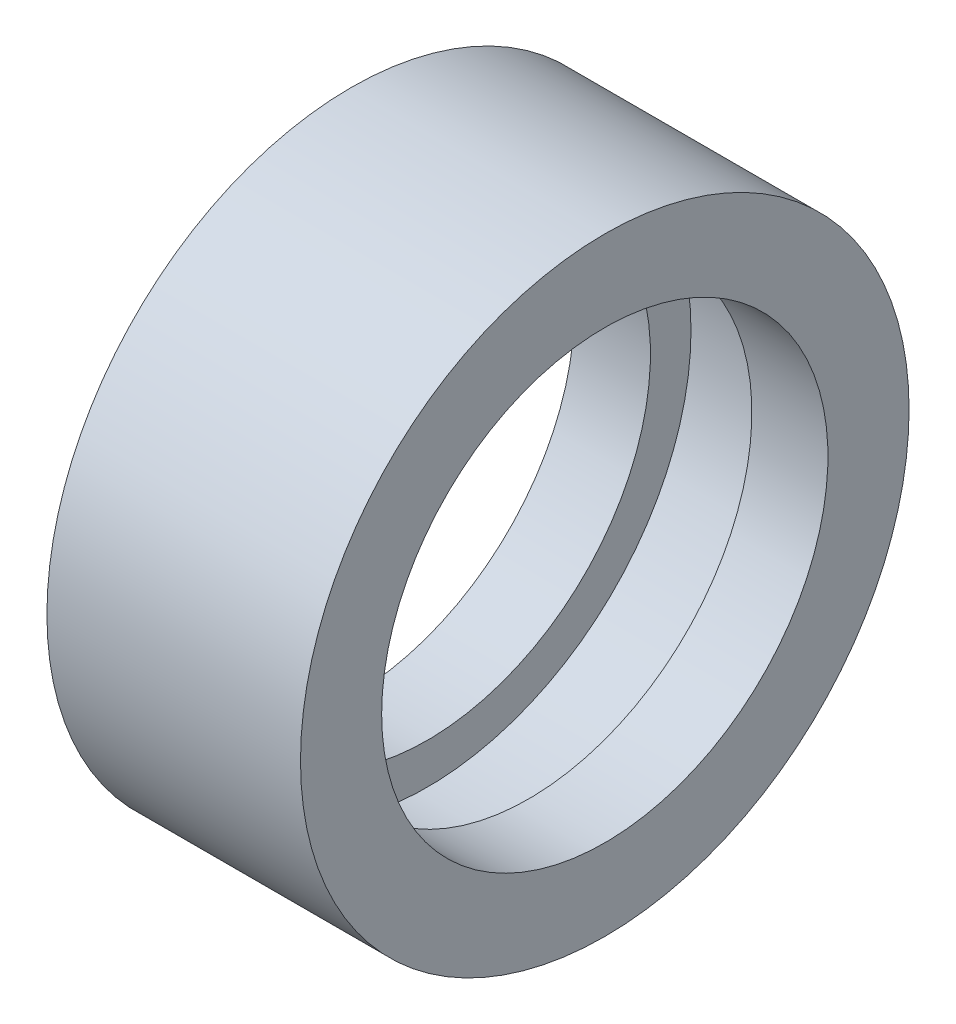
from build123d import *


with BuildPart() as part:
    # Esquisse1 → Révolution1 (revolve)
    with BuildSketch(Plane.XY, mode=Mode.PRIVATE) as r_volution1_sk:
        Polygon((5, 22), (12.5, 22), (12.5, 30), (-12.5, 30), (-12.5, 22), (-5, 22), (-5, 26), (5, 26), align=None)
    revolve(r_volution1_sk.sketch.rotate(Axis((-51, 0, 0), (1, 0, 0)), 90), axis=Axis((-51, 0, 0), (1, 0, 0)))


solid = part.part
